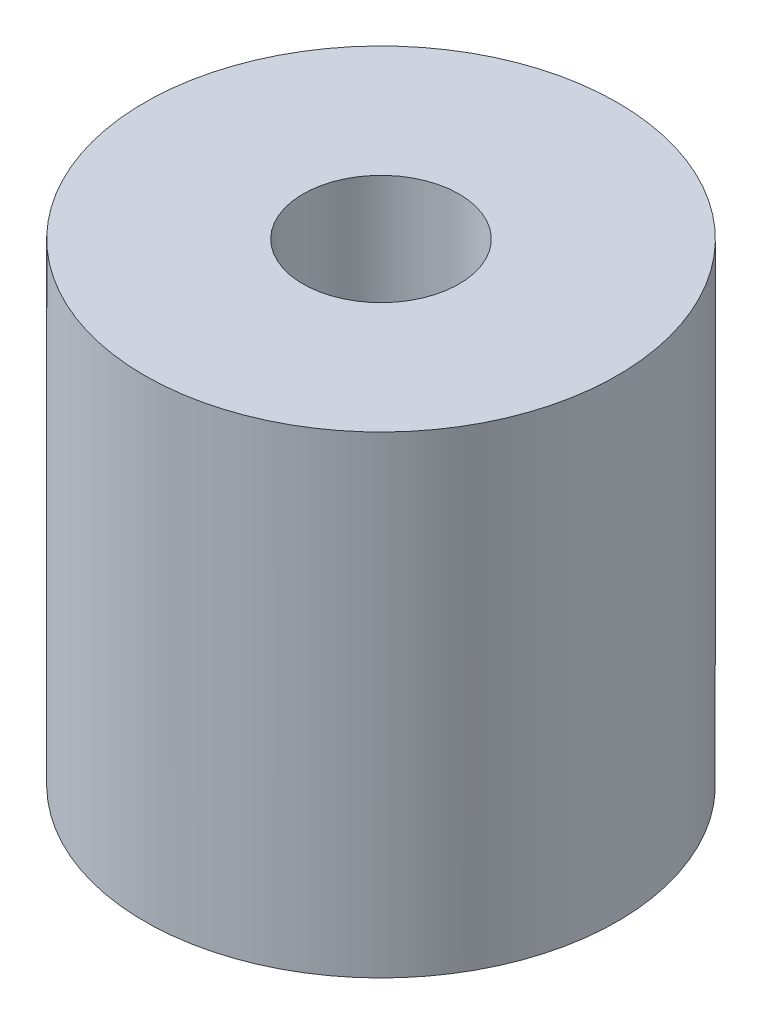
from build123d import *

# Parameters (mm, degrees)
SKETCH_1_R                   = 5
EXTRUDE_1_DEPTH              = 12
HOLE_WIZARD_M4_1_D           = 3.3
HOLE_WIZARD_M4_1_CSINK_D     = 4.05
HOLE_WIZARD_M4_1_CSINK_ANGLE = 90
SKETCH_7_R                   = 5
CUT_EXTRUDE_1_DEPTH          = 2


with BuildPart() as part:
    # 草图1 → 凸台-拉伸1 (new body)
    with BuildSketch(Plane(origin=(0, 0, 0), x_dir=(1, 0, 0), z_dir=(0, 1, 0))):
        with Locations(Location((0, 0, 0), (0, 0, 270))):
            Circle(SKETCH_1_R)
    extrude(amount=EXTRUDE_1_DEPTH)

    # M4 螺纹孔1 (through all)
    with Locations(Plane.XZ):
        with Locations((0, 0)):
            CounterSinkHole(HOLE_WIZARD_M4_1_D / 2, HOLE_WIZARD_M4_1_CSINK_D / 2, counter_sink_angle=HOLE_WIZARD_M4_1_CSINK_ANGLE)

    # 草图7 → 切除-拉伸1 (cut)
    with BuildSketch(Plane.XZ):
        with Locations(Location((0, 0, 0), (0, 0, 270))):
            Circle(SKETCH_7_R)
    extrude(amount=-CUT_EXTRUDE_1_DEPTH, mode=Mode.SUBTRACT)


solid = part.part
